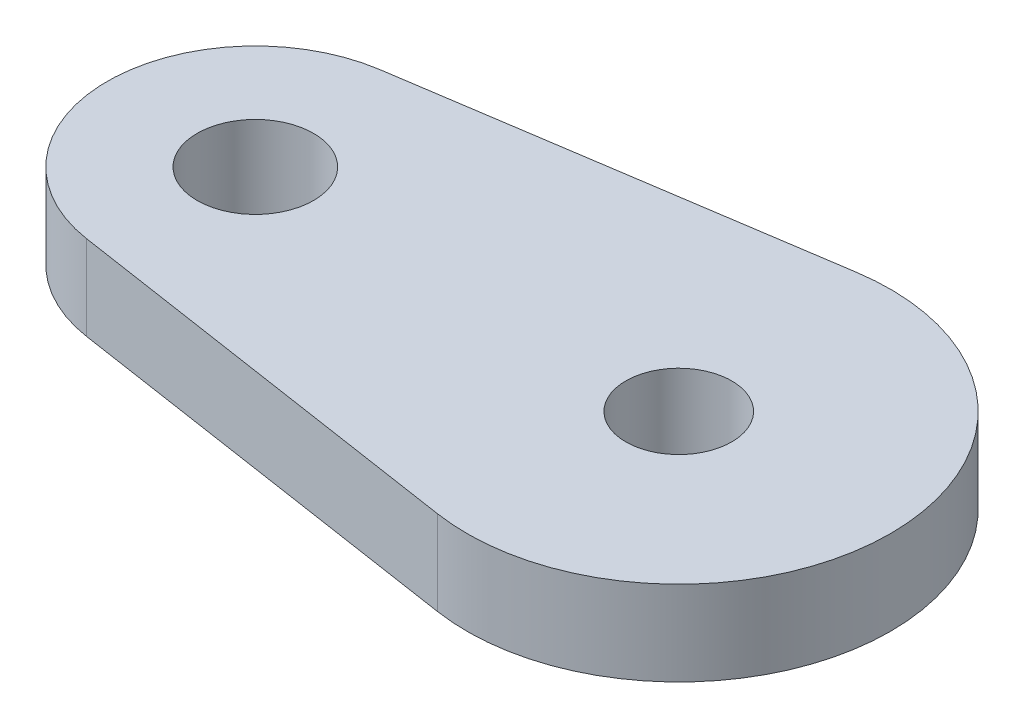
from build123d import *

# Parameters (mm, degrees)
SKETCH1_R           = 7
SKETCH1_R_2         = 2.75
SKETCH1_R_3         = 10
SKETCH1_R_4         = 2.5
BOSS_EXTRUDE1_DEPTH = 4


with BuildPart() as part:
    # Sketch1 → Boss-Extrude1 (new body)
    # profile 1 of 3: a face of its own
    with BuildSketch(Plane(origin=(0, 0, 0), x_dir=(1, 0, 0), z_dir=(0, 1, 0))):
        Circle(SKETCH1_R)
        with Locations(Location((0, 0, 0), (0, 0, 270))):
            Circle(SKETCH1_R_2, mode=Mode.SUBTRACT)
    # profile 2 of 3: a face of its own
    with BuildSketch(Plane(origin=(0, 0, 0), x_dir=(1, 0, 0), z_dir=(0, 1, 0))):
        with BuildLine():
            ThreePointArc((18.5, -9.886859967), (10, 0), (18.5, 9.886859967))
            Line((18.5, 9.886859967), (-1.05, 6.920801977))
            ThreePointArc((-1.05, 6.920801977), (4.563441684, 5.308012811), (7, 0))
            ThreePointArc((7, 0), (4.563441684, -5.308012811), (-1.05, -6.920801977))
            Line((-1.05, -6.920801977), (18.5, -9.886859967))
        make_face()
    # profile 3 of 3: a face of its own
    with BuildSketch(Plane(origin=(0, 0, 0), x_dir=(1, 0, 0), z_dir=(0, 1, 0))):
        with Locations((20, 0)):
            Circle(SKETCH1_R_3)
        with Locations(Location((20, 0, 0), (0, 0, 270))):
            Circle(SKETCH1_R_4, mode=Mode.SUBTRACT)
    extrude(amount=BOSS_EXTRUDE1_DEPTH)


solid = part.part
